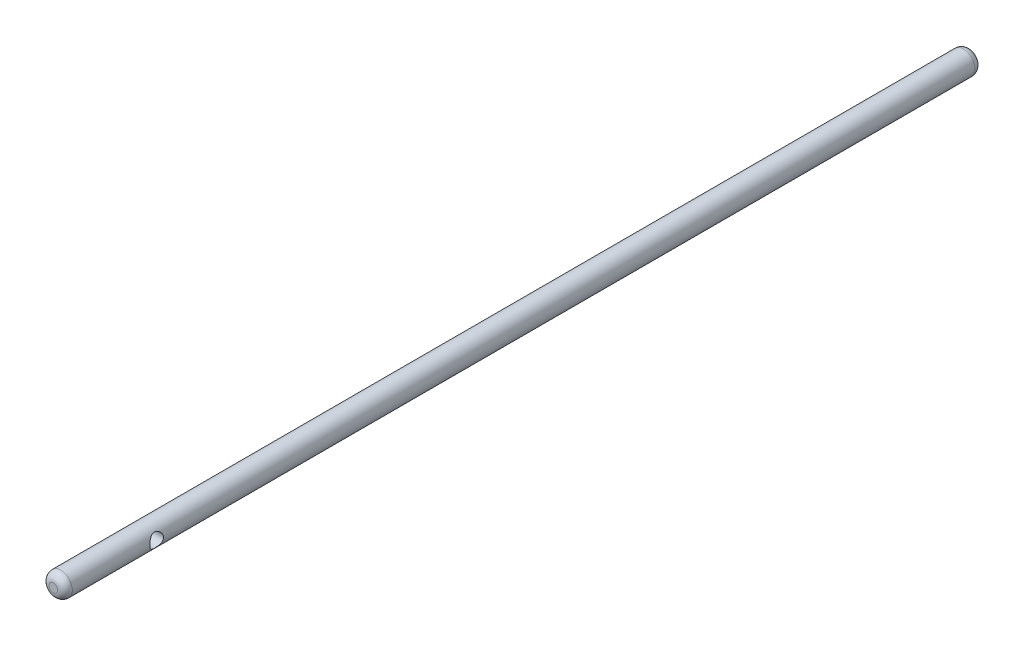
from build123d import *

# Parameters (mm, degrees)
BOSS_EXTRUDE1_DEPTH      = 500
BOSS_EXTRUDE1_DEPTH_BACK = 500
SKETCH1_R                = 12.7
FILLET1_R                = 8
CUT_EXTRUDE1_DEPTH       = 15
CUT_EXTRUDE1_DEPTH_BACK  = 19
SKETCH3_R                = 7.5


with BuildPart() as part:
    # Sketch1 → Boss-Extrude1 (new, two sides: drawn at the far end of the back side and taken through both)
    with BuildSketch(Plane.XY.offset(-BOSS_EXTRUDE1_DEPTH_BACK)):
        Circle(SKETCH1_R)
    extrude(amount=BOSS_EXTRUDE1_DEPTH + BOSS_EXTRUDE1_DEPTH_BACK)

    # Fillet1
    fillet1_edges = [part.edges().sort_by_distance(p)[0] for p in [
        (-12.7, 0, 500),
        (-12.7, 0, -500),
    ]]
    fillet(fillet1_edges, radius=FILLET1_R)

    # Sketch3 → Cut-Extrude1 (cut, two sides: drawn at the far end of the back side and taken through both)
    with BuildSketch(Plane(origin=(0, 0, 0), x_dir=(0, 0, -1), z_dir=(1, 0, 0)).offset(-CUT_EXTRUDE1_DEPTH_BACK)):
        with Locations((-400, 0.2)):
            Circle(SKETCH3_R)
    extrude(amount=CUT_EXTRUDE1_DEPTH + CUT_EXTRUDE1_DEPTH_BACK, mode=Mode.SUBTRACT)


solid = part.part
